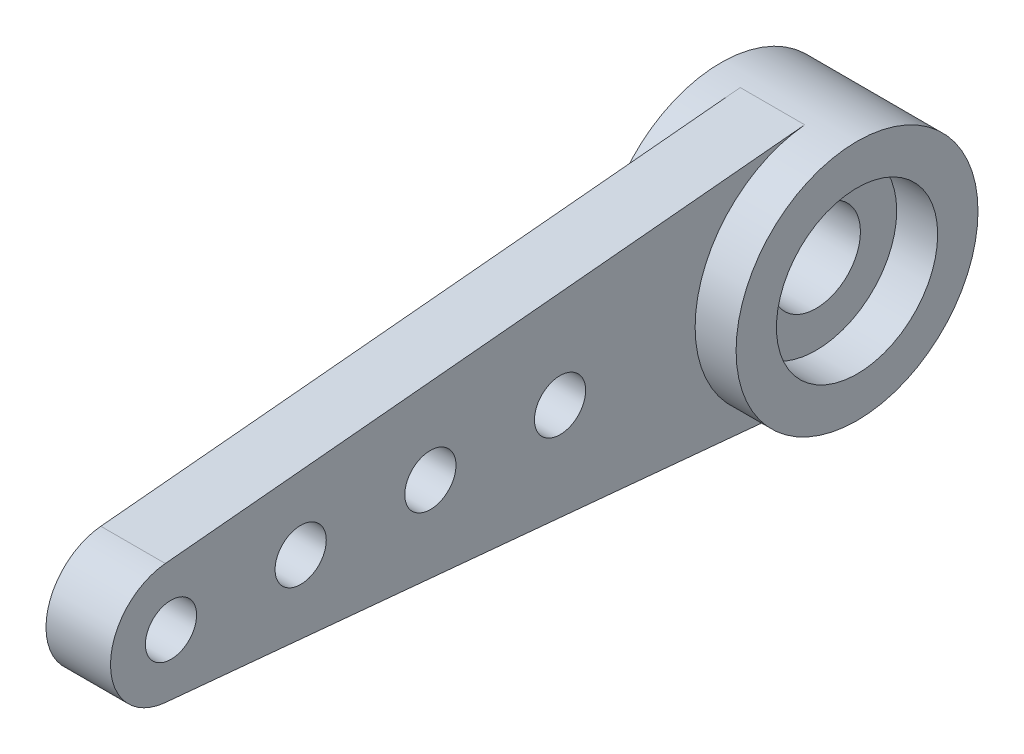
from build123d import *

# Parameters (mm, degrees)
SKETCH1_R           = 1.1
SKETCH1_R_2         = 0.635
BOSS_EXTRUDE1_DEPTH = 1.6
SKETCH2_R           = 3
SKETCH2_R_2         = 2
BOSS_EXTRUDE2_DEPTH = 1.016
BOSS_EXTRUDE3_START = 0.762
SKETCH3_R           = 3
SKETCH3_R_2         = 2
BOSS_EXTRUDE3_DEPTH = 0.762


with BuildPart() as part:
    # Sketch1 → Boss-Extrude1 (new body)
    with BuildSketch(Plane.YZ):
        with BuildLine():
            Line((-2.98678731, 0.28125), (-1.493393655, 16.140625))
            ThreePointArc((-1.493393655, 16.140625), (0, 17.5), (1.493393655, 16.140625))
            Line((1.493393655, 16.140625), (2.98678731, 0.28125))
            ThreePointArc((2.98678731, 0.28125), (0, -3), (-2.98678731, 0.28125))
        make_face()
        with Locations(Location((0, 0, 0), (0, 0, 270))):
            Circle(SKETCH1_R, mode=Mode.SUBTRACT)
        with Locations(Location((0, 16, 0), (0, 0, 270))):
            Circle(SKETCH1_R_2, mode=Mode.SUBTRACT)
        with Locations(Location((0, 12.783333333, 0), (0, 0, 270))):
            Circle(SKETCH1_R_2, mode=Mode.SUBTRACT)
        with Locations(Location((0, 9.566666667, 0), (0, 0, 270))):
            Circle(SKETCH1_R_2, mode=Mode.SUBTRACT)
        with Locations(Location((0, 6.35, 0), (0, 0, 270))):
            Circle(SKETCH1_R_2, mode=Mode.SUBTRACT)
    extrude(amount=BOSS_EXTRUDE1_DEPTH)

    # Sketch2 → Boss-Extrude2 (add)
    with BuildSketch(Plane.YZ.offset(1.6)):
        with Locations(Location((0, 0, 0), (0, 0, 5.379378991))):
            Circle(SKETCH2_R)
        with Locations(Location((0, 0, 0), (0, 0, 270))):
            Circle(SKETCH2_R_2, mode=Mode.SUBTRACT)
    extrude(amount=BOSS_EXTRUDE2_DEPTH)

    # Sketch3 → Boss-Extrude3 (add)
    with BuildSketch(Plane(origin=(0, 0, 0), x_dir=(0, -1, 0), z_dir=(-1, 0, 0)).offset(BOSS_EXTRUDE3_START)):
        with Locations(Location((0, 0, 0), (0, 0, 90))):
            Circle(SKETCH3_R)
        with Locations(Location((0, 0, 0), (0, 0, 270))):
            Circle(SKETCH3_R_2, mode=Mode.SUBTRACT)
    extrude(amount=-BOSS_EXTRUDE3_DEPTH)


solid = part.part
